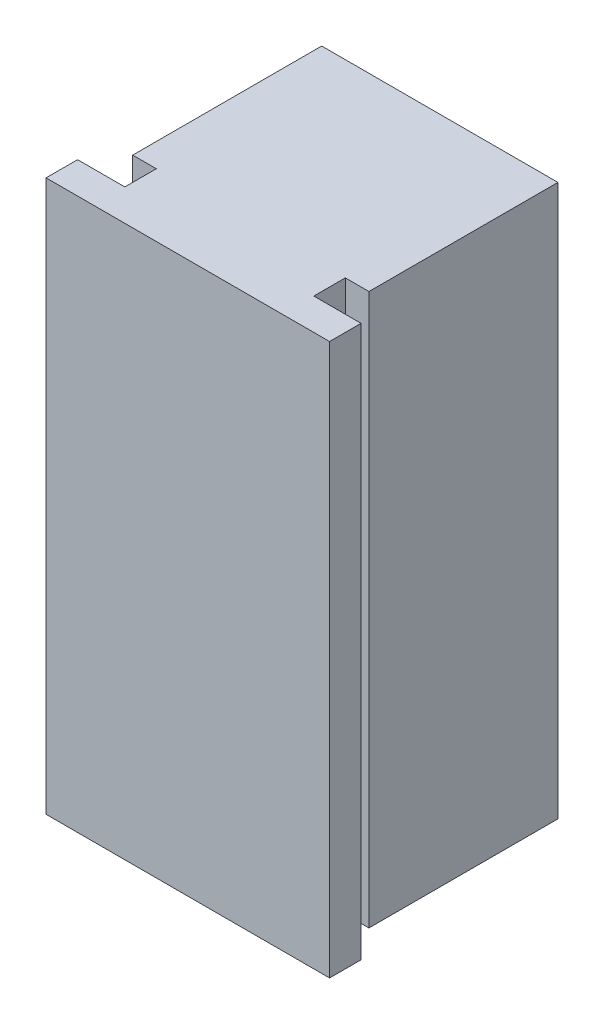
from build123d import *

# Parameters (mm, degrees)
SKETCH1_W           = 6
SKETCH1_H           = 2
BOSS_EXTRUDE1_DEPTH = 35
SKETCH2_R           = 4.5
CUT_EXTRUDE1_DEPTH  = 12


with BuildPart() as part:
    # Sketch1 → Boss-Extrude1 (new body)
    with BuildSketch(Plane(origin=(0, 0, 0), x_dir=(1, 0, 0), z_dir=(0, 1, 0))):
        Polygon((1.435483871, -3.161290323), (1.435483871, -15.161290323), (2.935483871, -15.161290323), (8.935483871, -15.161290323), (8.935483871, -3.161290323), align=None)
        Polygon((16.435483871, -3.161290323), (8.935483871, -3.161290323), (8.935483871, -15.161290323), (14.935483871, -15.161290323), (16.435483871, -15.161290323), align=None)
        with Locations((11.935483871, -16.161290323)):
            Rectangle(SKETCH1_W, SKETCH1_H)
        with Locations((5.935483871, -16.161290323)):
            Rectangle(SKETCH1_W, SKETCH1_H)
        Polygon((8.935483871, -17.161290323), (2.935483871, -17.161290323), (-0.064516129, -17.161290323), (-0.064516129, -19.161290323), (8.935483871, -19.161290323), align=None)
        Polygon((14.935483871, -17.161290323), (8.935483871, -17.161290323), (8.935483871, -19.161290323), (17.935483871, -19.161290323), (17.935483871, -17.161290323), align=None)
    extrude(amount=BOSS_EXTRUDE1_DEPTH)

    # Sketch2 → Cut-Extrude1 (cut)
    with BuildSketch(Plane(origin=(0, 0, 3.161290323), x_dir=(-1, 0, 0), z_dir=(0, 0, -1))):
        with Locations((-8.935483871, 17.5)):
            Circle(SKETCH2_R)
    extrude(amount=-CUT_EXTRUDE1_DEPTH, mode=Mode.SUBTRACT)


solid = part.part
